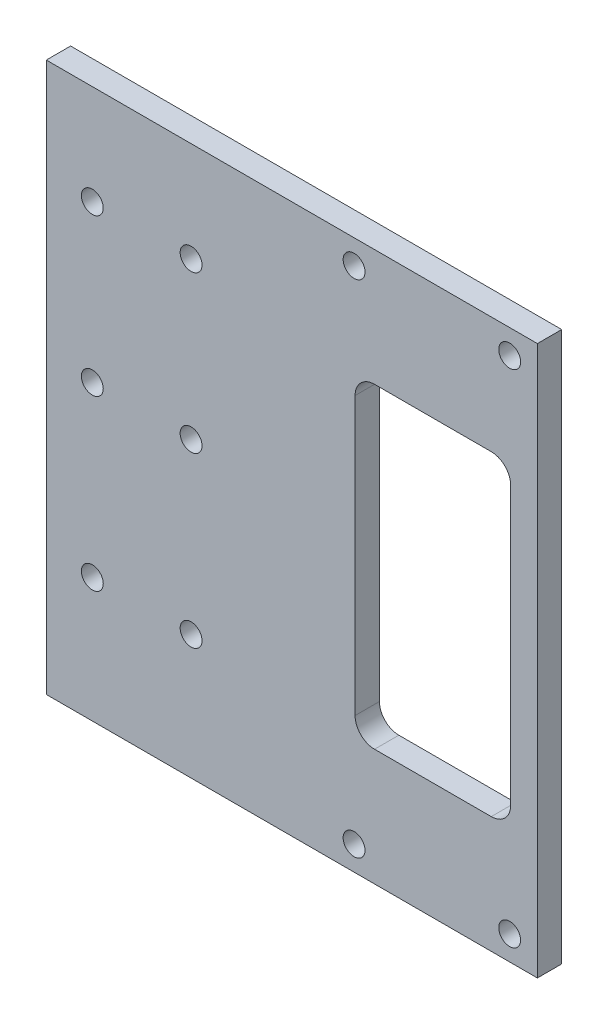
from build123d import *

# Parameters (mm, degrees)
ESQUISSE1_W          = 101
ESQUISSE1_H          = 113
BOSS_EXTRU_1_DEPTH   = 5
D_GAGEMENT_M42_D     = 4.5
M4_CLEARANCE_HOLE1_D = 4.5
CUT_EXTRUDE1_DEPTH   = 76.944058359


with BuildPart() as part:
    # Esquisse1 → Boss.-Extru.1 (new body)
    with BuildSketch(Plane.XY):
        Rectangle(ESQUISSE1_W, ESQUISSE1_H)
    extrude(amount=BOSS_EXTRU_1_DEPTH)

    # Dégagement M42 (through all)
    with Locations(Plane.XY.offset(5)):
        with Locations((-20.723129893, -30.91293976), (-20.723129893, 3.803464199), (-41.035821543, 3.803464199), (-41.035821543, -30.91293976), (-41.035821543, 35.983767161), (-20.723129893, 35.983767161)):
            Hole(D_GAGEMENT_M42_D / 2)

    # M4 Clearance Hole1 (through all)
    with Locations(Plane.XY.offset(5)):
        with Locations((44.8, 51.5), (12.8, 51.5), (12.8, -51.5), (44.8, -51.5)):
            Hole(M4_CLEARANCE_HOLE1_D / 2)

    # Sketch3 → Cut-Extrude1 (cut, through all)
    with BuildSketch(Plane.XY.offset(5)):
        with BuildLine():
            Line((45.008341295, 28.5), (45.008341295, -28.5))
            ThreePointArc((45.008341295, -28.5), (43.83676842, -31.328427125), (41.008341295, -32.5))
            Line((41.008341295, -32.5), (17.008341295, -32.5))
            ThreePointArc((17.008341295, -32.5), (14.17991417, -31.328427125), (13.008341295, -28.5))
            Line((13.008341295, -28.5), (13.008341295, 28.5))
            ThreePointArc((13.008341295, 28.5), (14.17991417, 31.328427125), (17.008341295, 32.5))
            Line((17.008341295, 32.5), (41.008341295, 32.5))
            ThreePointArc((41.008341295, 32.5), (43.83676842, 31.328427125), (45.008341295, 28.5))
        make_face()
    extrude(amount=-CUT_EXTRUDE1_DEPTH, mode=Mode.SUBTRACT)


solid = part.part
